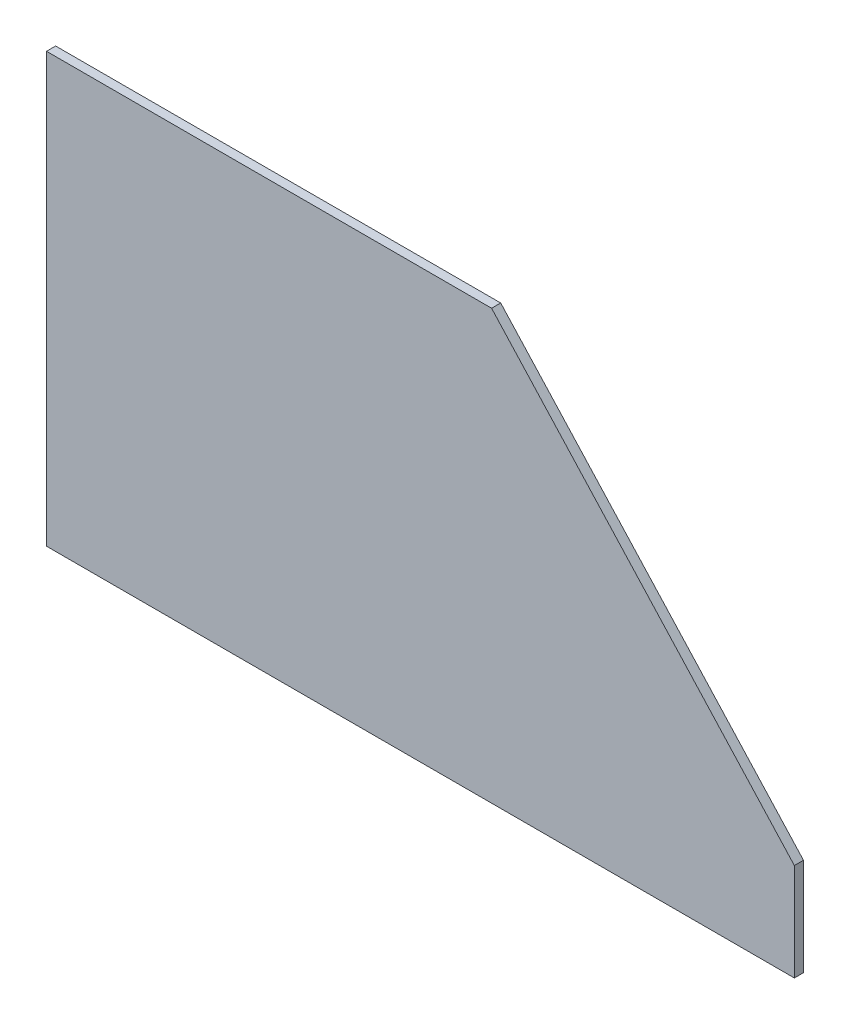
from build123d import *

# Parameters (mm, degrees)
BOSS_EXTRUDE1_DEPTH = 6.35


with BuildPart() as part:
    # Sketch1 → Boss-Extrude1 (new body)
    with BuildSketch(Plane.XY):
        Polygon((0, 0), (520.7, 0), (520.7, 67.818), (309.88, 298.45), (0, 298.45), align=None)
    extrude(amount=BOSS_EXTRUDE1_DEPTH)


solid = part.part
